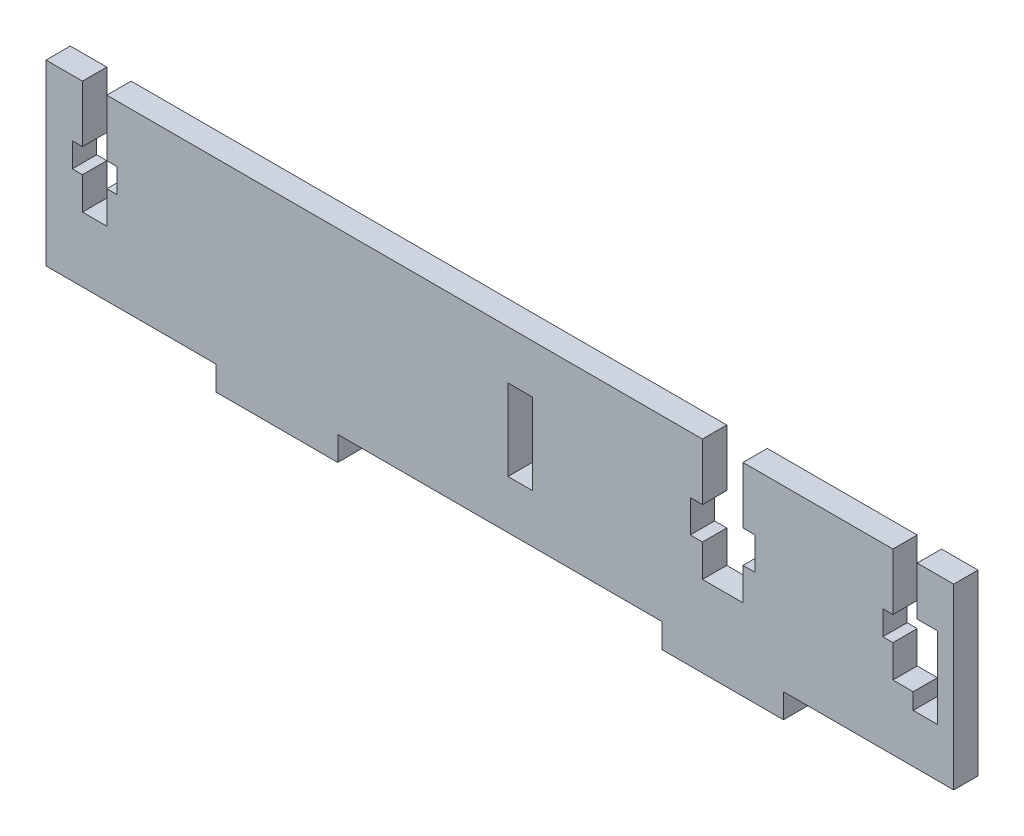
from build123d import *

# Parameters (mm, degrees)
BOSS_EXTRUDE1_DEPTH = 1.5
SKETCH2_W           = 3
SKETCH2_H           = 10
CUT_EXTRUDE1_DEPTH  = 58.801384066
CUT_EXTRUDE3_DEPTH  = 58.801384066
CUT_EXTRUDE4_DEPTH  = 58.801384066
SKETCH6_W           = 18.566482568
SKETCH6_H           = 17.933193013
BOSS_EXTRUDE3_DEPTH = 3


with BuildPart() as part:
    # Sketch1 → Boss-Extrude1 (new, symmetric)
    with BuildSketch(Plane.XY):
        Polygon((-20, -11), (20, -11), (20, -14), (35, -14), (35, -11), (56, -11), (56, 11), (-56, 11), (-56, -11), (-35, -11), (-35, -14), (-20, -14), align=None)
    extrude(amount=BOSS_EXTRUDE1_DEPTH, both=True)

    # Sketch2 → Cut-Extrude1 (cut, through all)
    with BuildSketch(Plane.XY.offset(1.5)):
        with Locations((2.5, 0)):
            Rectangle(SKETCH2_W, SKETCH2_H)
        with Locations((52.5, 0)):
            Rectangle(SKETCH2_W, SKETCH2_H)
    extrude(amount=-CUT_EXTRUDE1_DEPTH, mode=Mode.SUBTRACT)

    # Sketch4 → Cut-Extrude3 (cut, through all)
    with BuildSketch(Plane.XY.offset(1.5)):
        Polygon((25, 11), (25, 4), (23.5, 4), (23.5, 0), (25, 0), (25, -4), (30, -4), (30, 0), (31.5, 0), (31.5, 4), (30, 4), (30, 11), align=None)
        Polygon((-30, 11), (-25, 11), (-25, 4), (-23.5, 4), (-23.5, 0), (-25, 0), (-25, -4), (-30, -4), (-30, 0), (-31.5, 0), (-31.5, 4), (-30, 4), align=None)
    extrude(amount=-CUT_EXTRUDE3_DEPTH, mode=Mode.SUBTRACT)

    # Sketch5 → Cut-Extrude4 (cut, through all)
    with BuildSketch(Plane.XY.offset(1.5)):
        Polygon((-51.5, 11), (-51.5, 4), (-52.75, 4), (-52.75, 1), (-51.5, 1), (-51.5, -3), (-48.5, -3), (-48.5, 1), (-47.25, 1), (-47.25, 4), (-48.5, 4), (-48.5, 11), align=None)
        Polygon((48.5, 11), (51.5, 11), (51.5, 4), (52.75, 4), (52.75, 1), (51.5, 1), (51.5, -3), (48.5, -3), (48.5, 1), (47.25, 1), (47.25, 4), (48.5, 4), align=None)
    extrude(amount=-CUT_EXTRUDE4_DEPTH, mode=Mode.SUBTRACT)

    # Sketch6 → Boss-Extrude3 (add, through all)
    with BuildSketch(Plane.XY.offset(1.5)):
        with Locations((-26.473921785, 2.033403493)):
            Rectangle(SKETCH6_W, SKETCH6_H)
    extrude(amount=-BOSS_EXTRUDE3_DEPTH)


solid = part.part
